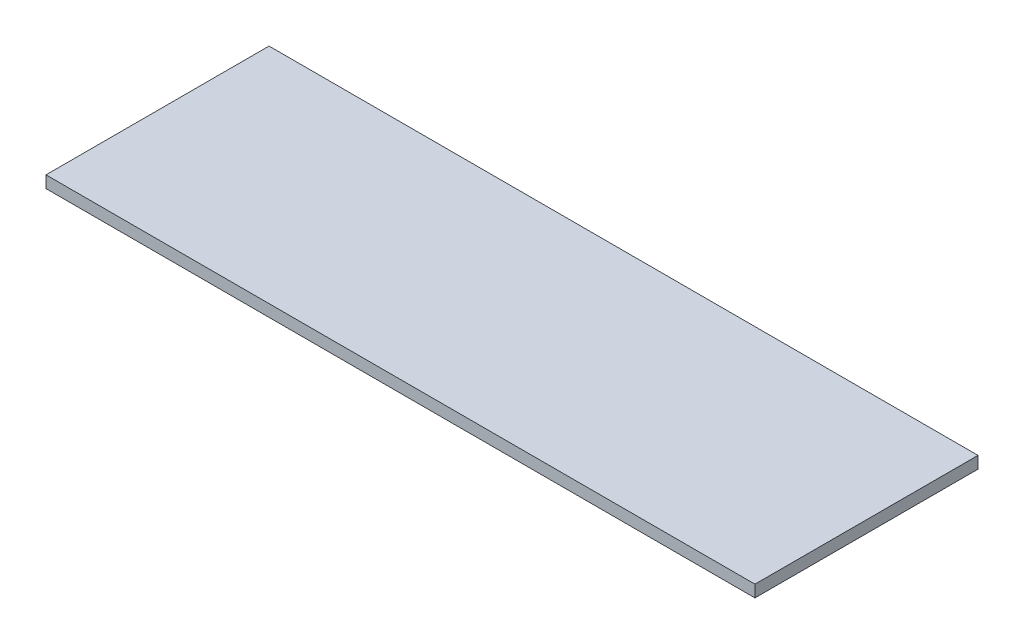
from build123d import *

# Parameters (mm, degrees)
SKETCH1_W           = 178
SKETCH1_H           = 56
BOSS_EXTRUDE1_DEPTH = 3


with BuildPart() as part:
    # Sketch1 → Boss-Extrude1 (new body)
    with BuildSketch(Plane(origin=(0, 0, 0), x_dir=(1, 0, 0), z_dir=(0, 1, 0))):
        Rectangle(SKETCH1_W, SKETCH1_H)
    extrude(amount=BOSS_EXTRUDE1_DEPTH)


solid = part.part
